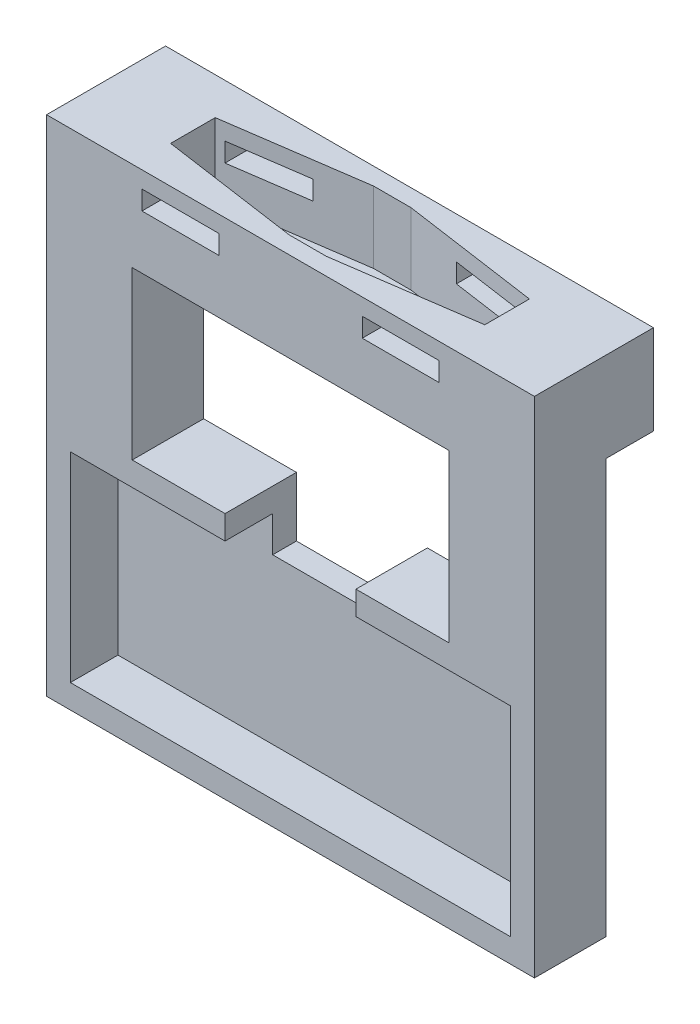
from build123d import *

# Parameters (mm, degrees)
SKETCH1_W                       = 52.07
SKETCH1_H                       = 26.416
ULTRASONIC_HOLDER_EXTRUDE_DEPTH = 7.62
ULTRASONIC_CUTOUT_T             = -2.54
ULTRASONIC_WIRE_HOLE_DEPTH      = 6.35
ULTRASONIC_WIRE_HOLE_DEPTH_BACK = 12.7
ULTRASONIC_WIRE_HOLE_START      = -26.416
SKETCH2_W                       = 13.97
SKETCH2_H                       = 7.62
SKETCH7_W                       = 12.7
SKETCH7_H                       = 9.56038728
SERVO_HOLDER_DEPTH              = 52.07
SKETCH10_W                      = 9.144
SKETCH10_H                      = 7.62
CONNECTOR_DEPTH                 = 20.32
SERVO_CUTOUT_DEPTH              = 7.62
SERVO_SECURER_CUT_DEPTH         = 76.909973478
SERVO_SECURER_CUT_DEPTH_BACK    = 76.909973478
SKETCH15_W                      = 8.215827997
SKETCH15_H                      = 2.032


with BuildPart() as part:
    # Sketch1 → Ultrasonic Holder Extrude (new body)
    with BuildSketch(Plane.XY):
        with Locations((26.035, 13.208)):
            Rectangle(SKETCH1_W, SKETCH1_H)
    extrude(amount=ULTRASONIC_HOLDER_EXTRUDE_DEPTH)

    # Ultrasonic Cutout
    ultrasonic_cutout_openings = [part.faces().sort_by_distance(p)[0] for p in [
        (26.035, 13.208, 7.62),
    ]]
    offset(amount=ULTRASONIC_CUTOUT_T, openings=ultrasonic_cutout_openings, kind=Kind.INTERSECTION)

    # Sketch2 → Ultrasonic Wire Hole (cut, two sides: drawn at the far end of the back side and taken through both)
    with BuildSketch(Plane.XZ.offset(ULTRASONIC_WIRE_HOLE_START - ULTRASONIC_WIRE_HOLE_DEPTH_BACK)):
        with Locations((26.035, 3.81)):
            Rectangle(SKETCH2_W, SKETCH2_H)
    extrude(amount=ULTRASONIC_WIRE_HOLE_DEPTH + ULTRASONIC_WIRE_HOLE_DEPTH_BACK, mode=Mode.SUBTRACT)



with BuildPart() as body_2:
    # Sketch7 → Servo Holder (new, through all)
    with BuildSketch(Plane.ZY):
        with Locations((1.27, 48.97619364)):
            Rectangle(SKETCH7_W, SKETCH7_H)
    extrude(amount=-SERVO_HOLDER_DEPTH)


with BuildPart() as part_1:
    add(part.part)

    add(body_2.part)  # Connector merges body 2
    # Sketch10 → Connector (add)
    with BuildSketch(Plane.XZ.offset(-44.196)):
        with Locations((4.572, 3.81)):
            Rectangle(SKETCH10_W, SKETCH10_H)
        with Locations((47.498, 3.81)):
            Rectangle(SKETCH10_W, SKETCH10_H)
    extrude(amount=CONNECTOR_DEPTH)

    # Sketch14 → Servo Cutout (cut)
    with BuildSketch(Plane.ZX.offset(53.75638728)):
        Polygon((-1.11125, 42.799), (3.65125, 42.799), (5.7785, 28.0162), (5.7785, 24.0538), (3.65125, 9.271), (-1.11125, 9.271), (-3.2385, 24.0538), (-3.2385, 28.0162), align=None)
    extrude(amount=-SERVO_CUTOUT_DEPTH, mode=Mode.SUBTRACT)

    # Sketch15 → Servo Securer Cut (cut, two sides: drawn at the far end of the back side and taken through both)
    with BuildSketch(Plane.XY.offset(7.62).offset(-SERVO_SECURER_CUT_DEPTH_BACK)):
        with Locations((14.288933515, 50.96238728)):
            Rectangle(SKETCH15_W, SKETCH15_H)
        with Locations((37.802086002, 50.96238728)):
            Rectangle(SKETCH15_W, SKETCH15_H)
    extrude(amount=SERVO_SECURER_CUT_DEPTH + SERVO_SECURER_CUT_DEPTH_BACK, mode=Mode.SUBTRACT)


solid = part_1.part
